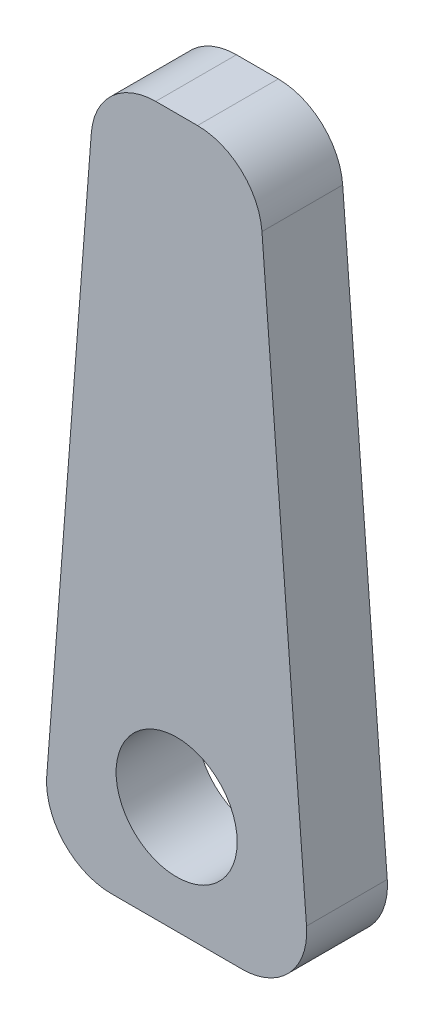
from build123d import *

# Parameters (mm, degrees)
SKETCH1_R           = 2.38125
BOSS_EXTRUDE1_DEPTH = 3.175


with BuildPart() as part:
    # Sketch1 → Boss-Extrude1 (new body)
    with BuildSketch(Plane.XY):
        with BuildLine():
            Line((-0.822880906, 165.1), (0.822880906, 165.1))
            ThreePointArc((0.822880906, 165.1), (2.548682875, 164.423654358), (3.355399299, 162.754809107))
            Line((3.355399299, 162.754809107), (5.107348017, 139.979475774))
            ThreePointArc((5.107348017, 139.979475774), (4.438483982, 138.058864698), (2.574829624, 137.244666667))
            Line((2.574829624, 137.244666667), (-2.574829624, 137.244666667))
            ThreePointArc((-2.574829624, 137.244666667), (-4.438483982, 138.058864698), (-5.107348017, 139.979475774))
            Line((-5.107348017, 139.979475774), (-3.355399299, 162.754809107))
            ThreePointArc((-3.355399299, 162.754809107), (-2.548682875, 164.423654358), (-0.822880906, 165.1))
        make_face()
        with Locations((0, 141.478000085)):
            Circle(SKETCH1_R, mode=Mode.SUBTRACT)
    extrude(amount=BOSS_EXTRUDE1_DEPTH)


solid = part.part
